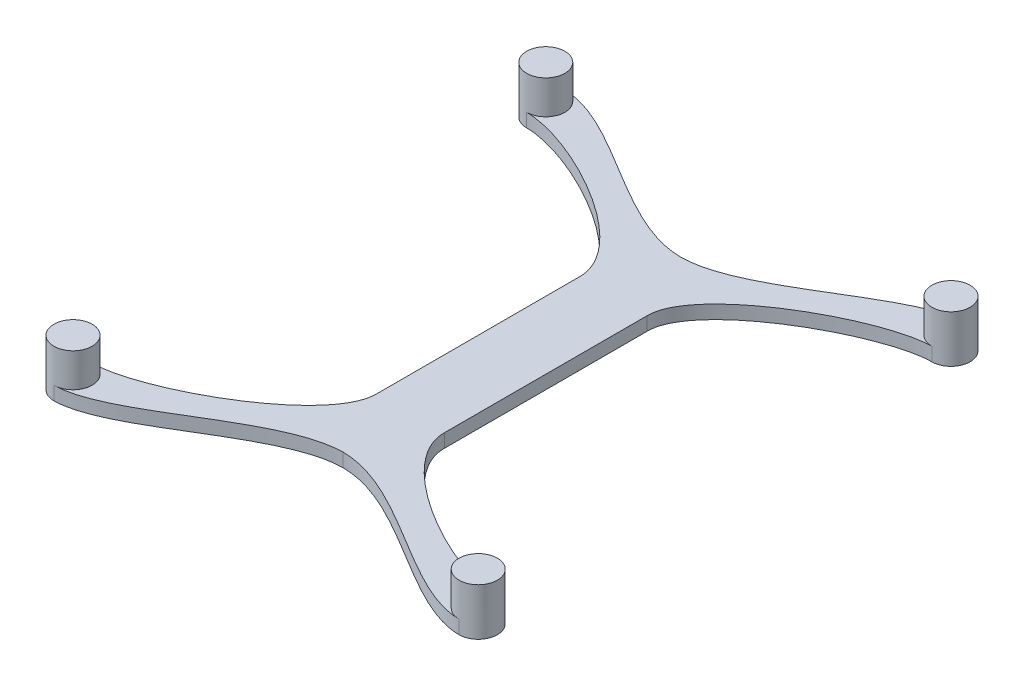
from build123d import *

# Parameters (mm, degrees)
BOSS_EXTRUDE1_DEPTH                        = 2.54
SKETCH2_R                                  = 3.594100000000004
BOSS_EXTRUDE2_DEPTH                        = 6.35
MIRROR1_AT_THE_SECOND_PLANE_COPY_1_DEPTH   = 2.54
MIRROR1_AT_THE_SECOND_PLANE_COPY_2_SKETC_R = 3.594100000000004
MIRROR1_AT_THE_SECOND_PLANE_COPY_2_DEPTH   = 6.35


with BuildPart() as part:
    # Sketch1 → Boss-Extrude1 (new body)
    with BuildSketch(Plane(origin=(0, 0, 0), x_dir=(1, 0, 0), z_dir=(0, 1, 0))):
        with BuildLine():
            Line((-6.35, -7.8e-16), (0, 0))
            Line((0, 0), (0, 31.75))
            add(Edge.make_bspline(
                [(0, 31.75), (-11.909179237119448, 31.827130893047123), (-27.615811236602134, 47.867470834719654), (-38.01020913703169, 48.0429782090805)],
                knots=[0, 0, 0, 0, 0.9971245716363047, 0.9971245716363047, 0.9971245716363047, 0.9971245716363047], degree=3))
            ThreePointArc((-38.01020913703169, 48.0429782090805), (-35.52703749049909, 46.95946582656603), (-34.5059, 44.44999999999999))
            ThreePointArc((-34.5059, 44.44999999999999), (-35.55858751773743, 41.908587517737416), (-38.1, 40.855899999999984))
            add(Edge.make_bspline(
                [(-6.35, 19.05), (-6.175250797111612, 28.394037165914764), (-28.752700179166496, 40.793112384563265), (-38.1, 40.855899999999984)],
                knots=[0, 0, 0, 0, 1, 1, 1, 1], degree=3))
            Line((-6.35, 19.05), (-6.35, -7.8e-16))
        make_face()
        with BuildLine():
            add(Edge.make_bspline(
                [(-38.01020913703169, 48.0429782090805), (-38.04018367320963, 48.043484323257836), (-38.07011403368422, 48.04385850798247), (-38.100000000000016, 48.04409999999999)],
                knots=[0.9971245716363047, 0.9971245716363047, 0.9971245716363047, 0.9971245716363047, 1, 1, 1, 1], degree=3))
            ThreePointArc((-38.01020913703169, 48.0429782090805), (-38.05510106491391, 48.04381954132759), (-38.100000000000016, 48.04409999999999))
        make_face()
        with BuildLine():
            ThreePointArc((-34.5059, 44.44999999999999), (-35.52703749049909, 46.95946582656603), (-38.01020913703169, 48.0429782090805))
            add(Edge.make_bspline(
                [(-38.01020913703169, 48.0429782090805), (-38.04018367320963, 48.043484323257836), (-38.07011403368422, 48.04385850798247), (-38.100000000000016, 48.04409999999999)],
                knots=[0.9971245716363047, 0.9971245716363047, 0.9971245716363047, 0.9971245716363047, 1, 1, 1, 1], degree=3))
            ThreePointArc((-38.100000000000016, 48.04409999999999), (-41.694100000000006, 44.44999999999998), (-38.1, 40.855899999999984))
            ThreePointArc((-38.1, 40.855899999999984), (-35.55858751773743, 41.908587517737416), (-34.5059, 44.44999999999999))
        make_face()
    boss_extrude1 = extrude(amount=BOSS_EXTRUDE1_DEPTH)

    # Sketch2 → Boss-Extrude2 (add)
    with BuildSketch(Plane(origin=(0, 2.54, 0), x_dir=(1, 0, 0), z_dir=(0, 1, 0))):
        with Locations(Location((-38.1, 44.44999999999999, 0), (0, 0, 270))):
            Circle(SKETCH2_R)
    boss_extrude2 = extrude(amount=BOSS_EXTRUDE2_DEPTH)

    # Mirror1: Boss-Extrude1, Boss-Extrude2 across plane
    add(boss_extrude1.mirror(Plane(origin=(0, 0, 0), x_dir=(0, 0, 1), z_dir=(1, 0, 0))))
    add(boss_extrude2.mirror(Plane(origin=(0, 0, 0), x_dir=(0, 0, 1), z_dir=(1, 0, 0))))

    # Mirror1 at the second plane: Boss-Extrude1, Boss-Extrude2 across plane
    add(boss_extrude1.mirror(Plane.XY))
    add(boss_extrude2.mirror(Plane.XY))

    # Mirror1 at the second plane copy 1 sketc → Mirror1 at the second plane copy 1 (add)
    with BuildSketch(Plane(origin=(0, 0, 0), x_dir=(-1, 0, 0), z_dir=(0, 1, 0))):
        with BuildLine():
            Line((-6.35, -7.8e-16), (0, 0))
            Line((0, 0), (0, 31.75))
            add(Edge.make_bspline(
                [(0, 31.75), (-11.909179237119448, 31.827130893047123), (-27.615811236602134, 47.867470834719654), (-38.01020913703169, 48.0429782090805)],
                knots=[0, 0, 0, 0, 0.9971245716363047, 0.9971245716363047, 0.9971245716363047, 0.9971245716363047], degree=3))
            ThreePointArc((-38.01020913703169, 48.0429782090805), (-35.52703749049909, 46.95946582656603), (-34.5059, 44.44999999999999))
            ThreePointArc((-34.5059, 44.44999999999999), (-35.55858751773743, 41.908587517737416), (-38.1, 40.855899999999984))
            add(Edge.make_bspline(
                [(-6.35, 19.05), (-6.175250797111612, 28.394037165914764), (-28.752700179166496, 40.793112384563265), (-38.1, 40.855899999999984)],
                knots=[0, 0, 0, 0, 1, 1, 1, 1], degree=3))
            Line((-6.35, 19.05), (-6.35, -7.8e-16))
        make_face()
        with BuildLine():
            add(Edge.make_bspline(
                [(-38.01020913703169, 48.0429782090805), (-38.04018367320963, 48.043484323257836), (-38.07011403368422, 48.04385850798247), (-38.100000000000016, 48.04409999999999)],
                knots=[0.9971245716363047, 0.9971245716363047, 0.9971245716363047, 0.9971245716363047, 1, 1, 1, 1], degree=3))
            ThreePointArc((-38.01020913703169, 48.0429782090805), (-38.05510106491391, 48.04381954132759), (-38.100000000000016, 48.04409999999999))
        make_face()
        with BuildLine():
            ThreePointArc((-34.5059, 44.44999999999999), (-35.52703749049909, 46.95946582656603), (-38.01020913703169, 48.0429782090805))
            add(Edge.make_bspline(
                [(-38.01020913703169, 48.0429782090805), (-38.04018367320963, 48.043484323257836), (-38.07011403368422, 48.04385850798247), (-38.100000000000016, 48.04409999999999)],
                knots=[0.9971245716363047, 0.9971245716363047, 0.9971245716363047, 0.9971245716363047, 1, 1, 1, 1], degree=3))
            ThreePointArc((-38.100000000000016, 48.04409999999999), (-41.694100000000006, 44.44999999999998), (-38.1, 40.855899999999984))
            ThreePointArc((-38.1, 40.855899999999984), (-35.55858751773743, 41.908587517737416), (-34.5059, 44.44999999999999))
        make_face()
    extrude(amount=MIRROR1_AT_THE_SECOND_PLANE_COPY_1_DEPTH)

    # Mirror1 at the second plane copy 2 sketc → Mirror1 at the second plane copy 2 (add)
    with BuildSketch(Plane(origin=(0, 2.54, 0), x_dir=(-1, 0, 0), z_dir=(0, 1, 0))):
        with Locations(Location((-38.1, 44.44999999999999, 0), (0, 0, 270))):
            Circle(MIRROR1_AT_THE_SECOND_PLANE_COPY_2_SKETC_R)
    extrude(amount=MIRROR1_AT_THE_SECOND_PLANE_COPY_2_DEPTH)


solid = part.part
